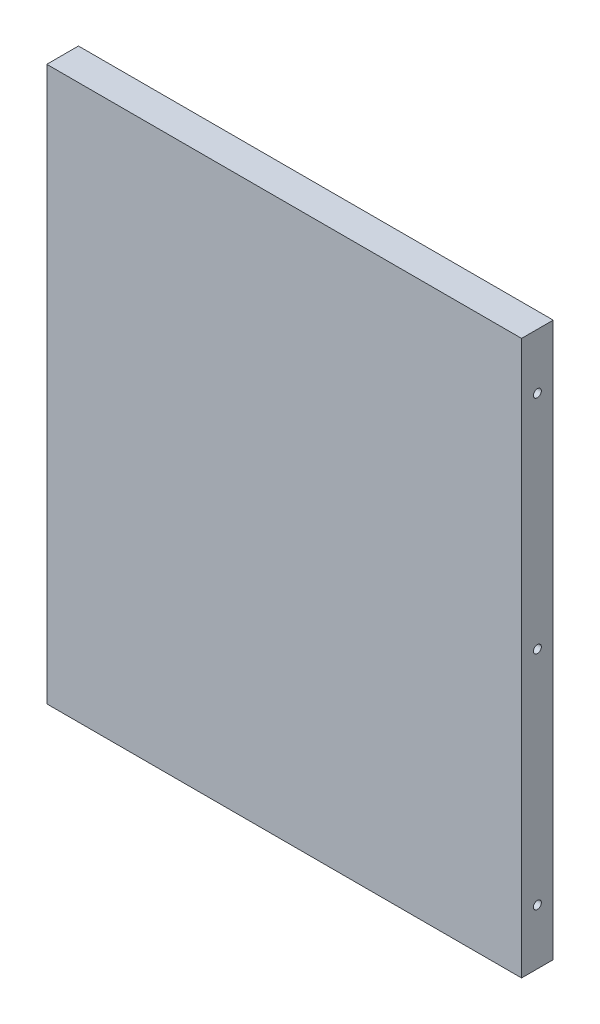
from build123d import *

# Parameters (mm, degrees)
SKIZZE1_W                       = 150
SKIZZE1_H                       = 175
AUFSATZ_LINEAR_AUSTRAGEN1_DEPTH = 10
SKIZZE2_R                       = 1.25
SCHNITT_LINEAR_AUSTRAGEN1_DEPTH = 5
SCHNITT_LINEAR_START            = -5
SKIZZE3_R                       = 1.25
SCHNITT_LINEAR_AUSTRAGEN2_DEPTH = 5


with BuildPart() as part:
    # Skizze1 → Aufsatz-Linear austragen1 (new body)
    with BuildSketch(Plane.XY):
        with Locations((-9.70090245, -21.923076923)):
            Rectangle(SKIZZE1_W, SKIZZE1_H)
    extrude(amount=AUFSATZ_LINEAR_AUSTRAGEN1_DEPTH)

    # Skizze2 → Schnitt-Linear austragen1 (cut)
    with BuildSketch(Plane.ZY.offset(84.70090245)):
        with Locations(Location((5, 48.076923077, 0), (0, 0, 270))):
            Circle(SKIZZE2_R)
        with Locations(Location((5, -21.923076923, 0), (0, 0, 270))):
            Circle(SKIZZE2_R)
        with Locations(Location((5, -91.923076923, 0), (0, 0, 270))):
            Circle(SKIZZE2_R)
    extrude(amount=-SCHNITT_LINEAR_AUSTRAGEN1_DEPTH, mode=Mode.SUBTRACT)

    # Skizze3 → Schnitt-Linear austragen2 (cut)
    with BuildSketch(Plane(origin=(65.29909755, 0, 0), x_dir=(0, 0, -1), z_dir=(1, 0, 0)).offset(SCHNITT_LINEAR_START)):
        with Locations(Location((-5, 48.076923077, 0), (0, 0, 270))):
            Circle(SKIZZE3_R)
        with Locations(Location((-5, -21.923076923, 0), (0, 0, 270))):
            Circle(SKIZZE3_R)
        with Locations(Location((-5, -91.923076923, 0), (0, 0, 270))):
            Circle(SKIZZE3_R)
    extrude(amount=SCHNITT_LINEAR_AUSTRAGEN2_DEPTH, mode=Mode.SUBTRACT)


solid = part.part
